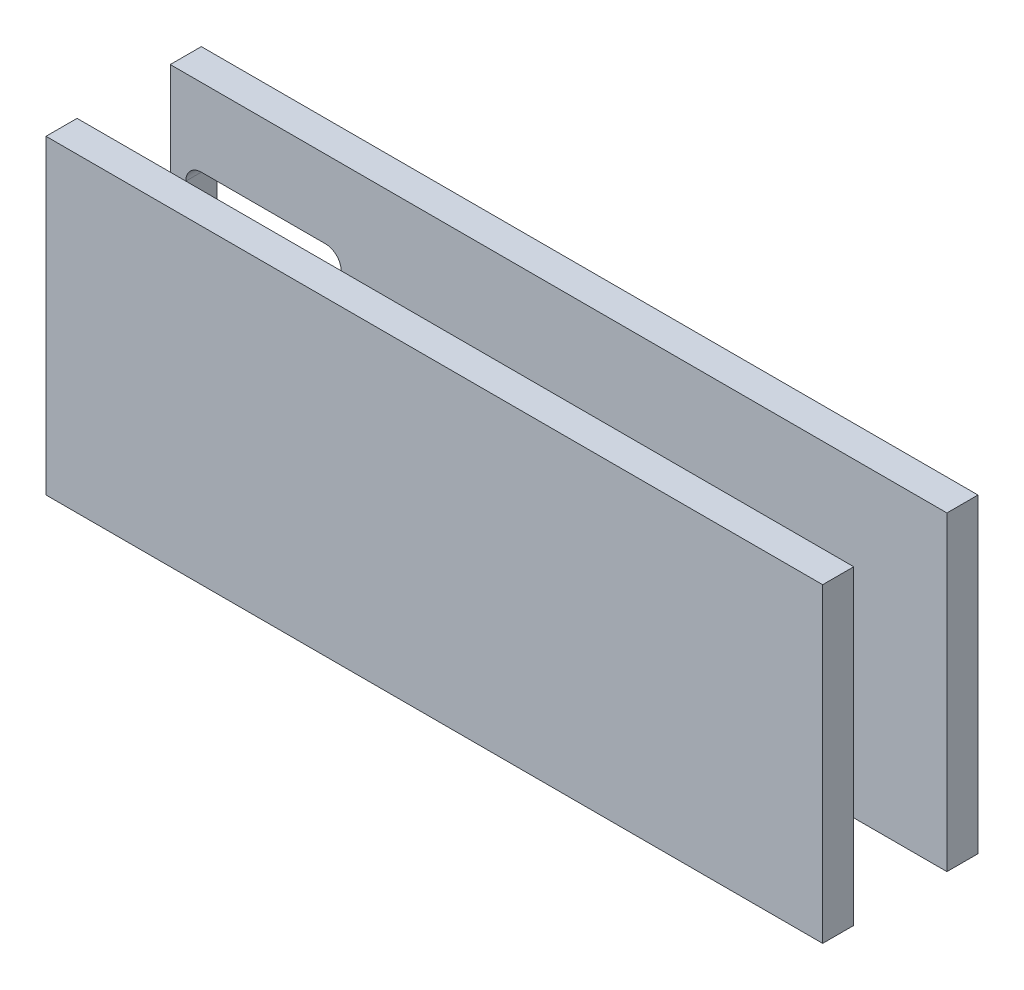
from build123d import *

# Parameters (mm, degrees)
SKETCH1_W           = 250
SKETCH1_H           = 100
BOSS_EXTRUDE1_DEPTH = 10
SKETCH2_R           = 5
BOSS_EXTRUDE2_DEPTH = 30
SKETCH3_W           = 250
SKETCH3_H           = 100
BOSS_EXTRUDE3_DEPTH = 10
SKETCH5_W           = 50
SKETCH5_H           = 50
CUT_EXTRUDE1_DEPTH  = 10
FILLET1_R           = 5


with BuildPart() as part:
    # Sketch1 → Boss-Extrude1 (new body)
    with BuildSketch(Plane.XY):
        Rectangle(SKETCH1_W, SKETCH1_H)
    extrude(amount=BOSS_EXTRUDE1_DEPTH)

    # Sketch2 → Boss-Extrude2 (add)
    with BuildSketch(Plane.XY.offset(10)):
        with Locations((75, 0)):
            Circle(SKETCH2_R)
        with Locations((-25, 0)):
            Circle(SKETCH2_R)
    extrude(amount=BOSS_EXTRUDE2_DEPTH)

    # Sketch3 → Boss-Extrude3 (add)
    with BuildSketch(Plane.XY.offset(40)):
        Rectangle(SKETCH3_W, SKETCH3_H)
    extrude(amount=BOSS_EXTRUDE3_DEPTH)

    # Sketch5 → Cut-Extrude1 (cut)
    with BuildSketch(Plane(origin=(0, 0, 0), x_dir=(-1, 0, 0), z_dir=(0, 0, -1))):
        with Locations((95, 0)):
            Rectangle(SKETCH5_W, SKETCH5_H)
    extrude(amount=-CUT_EXTRUDE1_DEPTH, mode=Mode.SUBTRACT)

    # Fillet1
    fillet1_edges = [part.edges().sort_by_distance(p)[0] for p in [
        (-120, 25, 5),
        (-120, -25, 5),
        (-70, -25, 5),
        (-70, 25, 5),
    ]]
    fillet(fillet1_edges, radius=FILLET1_R)


solid = part.part
